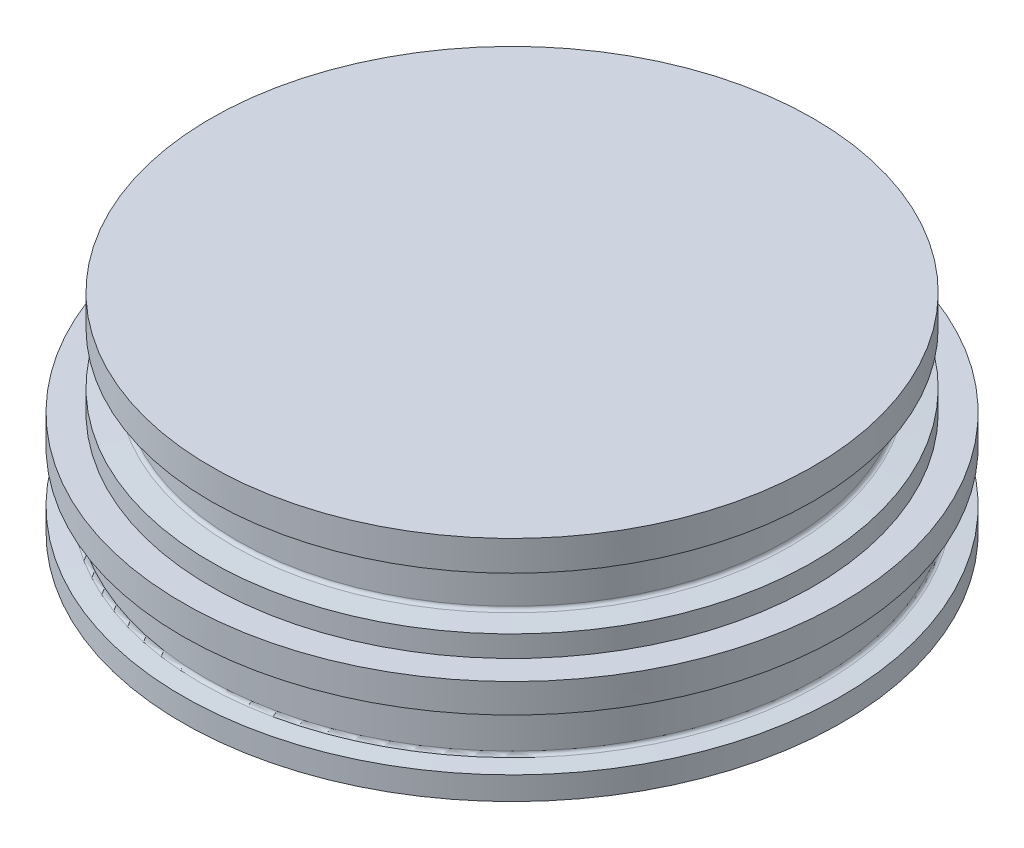
from build123d import *


with BuildPart() as part:
    # Sketch1 → Revolve1 (revolve)
    with BuildSketch(Plane.XY, mode=Mode.PRIVATE) as revolve1_sk:
        Polygon((-22.0853, 0), (-22.0853, -7.62), (-24.1554, -7.62), (-24.1554, -15.24), (0, -15.24), (0, 0), align=None)
    revolve(revolve1_sk.sketch.rotate(Axis((0, 0, 0), (0, 1, 0)), 270), axis=Axis((0, 0, 0), (0, 1, 0)))

    # Sketch7 → Groove for AS 568-132, O-Ring1 (revolve, cut)
    with BuildSketch(Plane(origin=(0, 0, 0), x_dir=(0, 0, -1), z_dir=(-1, 0, 0)), mode=Mode.PRIVATE) as groove_for_as_568_132_o_ring1_sk:
        with BuildLine():
            Line((22.774362441, 13.425029581), (24.6888, 13.592521165))
            Line((24.6888, 13.592521165), (24.6888, 9.701537998))
            Line((24.6888, 9.701537998), (22.774362441, 9.869029581))
            ThreePointArc((22.774362441, 9.869029581), (22.609231556, 9.950463122), (22.5425, 10.122063035))
            Line((22.5425, 10.122063035), (22.5425, 13.171996128))
            ThreePointArc((22.5425, 13.171996128), (22.609231556, 13.343596041), (22.774362441, 13.425029581))
        make_face()
    revolve(groove_for_as_568_132_o_ring1_sk.sketch.rotate(Axis((0, -50, 0), (0, 1, 0)), 180), axis=Axis((0, -50, 0), (0, 1, 0)), mode=Mode.SUBTRACT)

    # Sketch9 → Groove for AS 568-129, O-Ring1 (revolve, cut)
    with BuildSketch(Plane(origin=(0, 0, 0), x_dir=(0, 0, -1), z_dir=(-1, 0, 0))):
        with BuildLine():
            Line((20.399462441, 5.913991542), (22.3139, 6.081483126))
            Line((22.3139, 6.081483126), (22.3139, 2.190499959))
            Line((22.3139, 2.190499959), (20.399462441, 2.357991542))
            ThreePointArc((20.399462441, 2.357991542), (20.234331556, 2.439425083), (20.1676, 2.611024996))
            Line((20.1676, 2.611024996), (20.1676, 5.660958089))
            ThreePointArc((20.1676, 5.660958089), (20.234331556, 5.832558002), (20.399462441, 5.913991542))
        make_face()
    revolve(axis=Axis((0, -50, 0), (0, 1, 0)), mode=Mode.SUBTRACT)


solid = part.part
